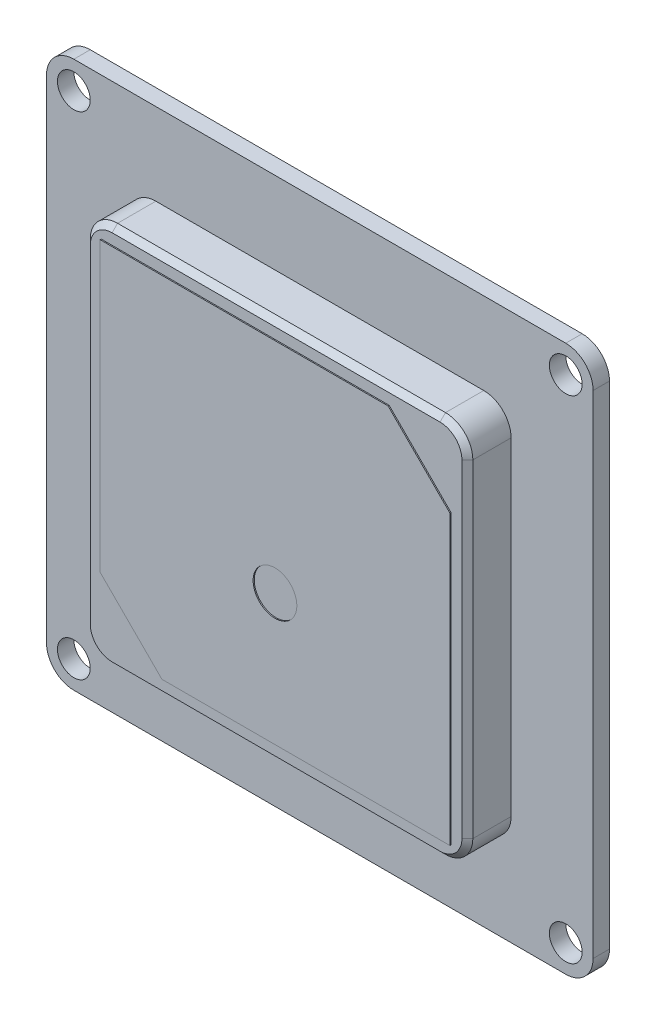
from build123d import *

# Parameters (mm, degrees)
SKETCH1_W                    = 50
SKETCH1_H                    = 50
BOSS_EXTRUDE1_DEPTH          = 1.5
SKETCH2_W                    = 35
SKETCH2_H                    = 35
BOSS_EXTRUDE2_DEPTH          = 4
SKETCH3_W                    = 32
SKETCH3_H                    = 32
BOSS_EXTRUDE3_DEPTH          = 0.1
F_3_0_3_DIAMETER_HOLE1_D     = 3
F_4_0_4_DIAMETER_HOLE1_D     = 4
F_4_0_4_DIAMETER_HOLE1_DEPTH = 0.1
FILLET1_R                    = 2.5
CHAMFER1_SIZE                = 5.656854249
CHAMFER2_SIZE                = 0.5
SKETCH8_W                    = 30
SKETCH8_H                    = 30
BOSS_EXTRUDE4_DEPTH          = 5


with BuildPart() as part:
    # Sketch1 → Boss-Extrude1 (new body)
    with BuildSketch(Plane.XY.offset(1.5)):
        Rectangle(SKETCH1_W, SKETCH1_H)
    extrude(amount=-BOSS_EXTRUDE1_DEPTH)

    # Sketch2 → Boss-Extrude2 (add)
    with BuildSketch(Plane.XY.offset(1.5)):
        Rectangle(SKETCH2_W, SKETCH2_H)
    extrude(amount=BOSS_EXTRUDE2_DEPTH)

    # Sketch3 → Boss-Extrude3 (add)
    with BuildSketch(Plane.XY.offset(5.5)):
        Rectangle(SKETCH3_W, SKETCH3_H)
    extrude(amount=BOSS_EXTRUDE3_DEPTH)

    # Ø3.0 (3) Diameter Hole1 (through all)
    with Locations(Plane.XY.offset(1.5)):
        with Locations((22.5, -22.5), (-22.5, 22.5), (22.5, 22.5), (-22.5, -22.5)):
            Hole(F_3_0_3_DIAMETER_HOLE1_D / 2)

    # Ø4.0 (4) Diameter Hole1
    with Locations(Plane.XY.offset(5.6)):
        with Locations((0, -4)):
            Hole(F_4_0_4_DIAMETER_HOLE1_D / 2, depth=F_4_0_4_DIAMETER_HOLE1_DEPTH)

    # Fillet1
    fillet1_edges = [part.edges().sort_by_distance(p)[0] for p in [
        (-17.5, 17.5, 3.5),
        (-17.5, -17.5, 3.5),
        (17.5, -17.5, 3.5),
        (17.5, 17.5, 3.5),
        (25, -25, 0.75),
        (-25, -25, 0.75),
        (-25, 25, 0.75),
        (25, 25, 0.75),
    ]]
    fillet(fillet1_edges, radius=FILLET1_R)

    # Chamfer1
    chamfer1_edges = [part.edges().sort_by_distance(p)[0] for p in [
        (16, 16, 5.55),
        (-16, -16, 5.55),
    ]]
    chamfer(chamfer1_edges, length=CHAMFER1_SIZE)

    # Chamfer2
    chamfer2_edges = [part.edges().sort_by_distance(p)[0] for p in [
        (17.5, 0, 5.5),
        (0, -17.5, 5.5),
        (-17.5, 0, 5.5),
        (0, 17.5, 5.5),
        (-16.767766953, 16.767766953, 5.5),
        (-16.767766953, -16.767766953, 5.5),
        (16.767766953, 16.767766953, 5.5),
        (16.767766953, -16.767766953, 5.5),
    ]]
    chamfer(chamfer2_edges, length=CHAMFER2_SIZE)

    # Sketch8 → Boss-Extrude4 (add)
    with BuildSketch(Plane(origin=(0, 0, 0), x_dir=(-1, 0, 0), z_dir=(0, 0, -1))):
        with Locations((10, 0.618109873)):
            Rectangle(SKETCH8_W, SKETCH8_H)
    extrude(amount=BOSS_EXTRUDE4_DEPTH)


solid = part.part
